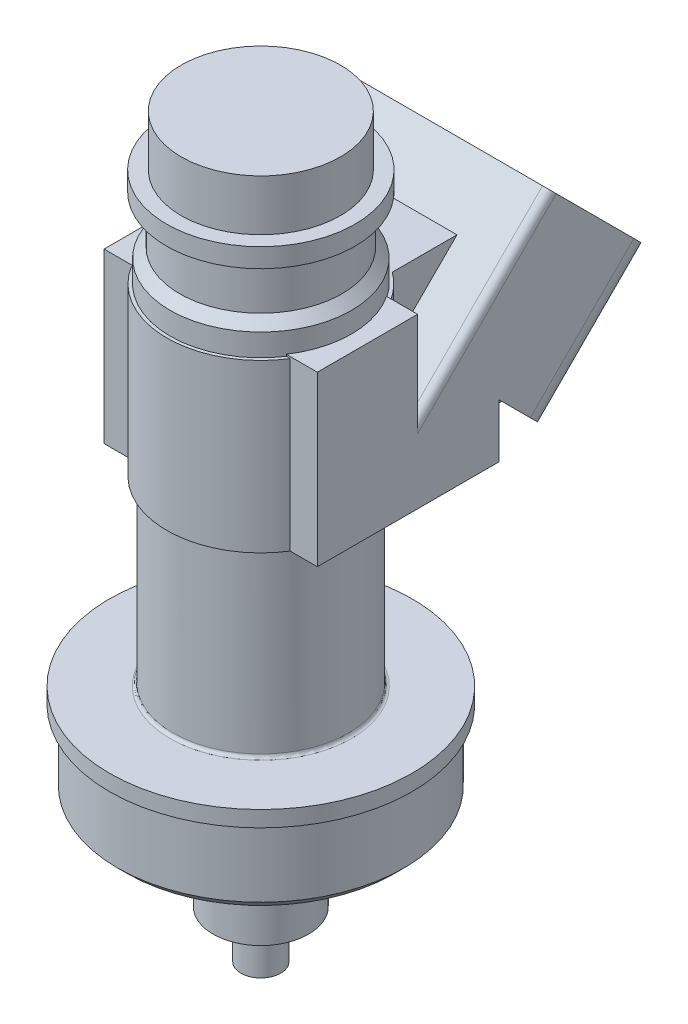
from build123d import *

# Parameters (mm, degrees)
SKETCH1_R          = 1.5875
EXTRUDE1_DEPTH     = 3.81
SKETCH2_R          = 3.81
EXTRUDE2_DEPTH     = 7.62
SKETCH3_R          = 11.43
EXTRUDE3_DEPTH     = 6.35
SKETCH4_R          = 12.065
EXTRUDE4_DEPTH     = 1.27
SKETCH5_R          = 7
EXTRUDE5_DEPTH     = 14.5
SKETCH6_R          = 7.5
EXTRUDE6_DEPTH     = 13.3
SKETCH7_R          = 7.239
EXTRUDE7_DEPTH     = 2.54
CHAMFER6_SIZE      = 0.762
SKETCH8_R          = 6.477
EXTRUDE8_DEPTH     = 3.81
SKETCH9_R          = 0.79375
CUT_EXTRUDE1_DEPTH = 2.54
CHAMFER1_SIZE      = 1.27
CHAMFER1_SIZE2     = 0.462242198
SKETCH10_R         = 7.518539915
EXTRUDE9_DEPTH     = 1.524
SKETCH11_R         = 6.35
EXTRUDE10_DEPTH    = 4.064
FILLET1_R          = 0.254
CHAMFER7_SIZE      = 0.762
EXTRUDE11_DEPTH    = 8.509
SKETCH13_W         = 13.97
SKETCH13_H         = 8.89
CUT_EXTRUDE2_DEPTH = 10.414
SKETCH14_W         = 2.763435098
SKETCH14_H         = 1.082967808
SKETCH14_W_2       = 3.024841121
EXTRUDE12_DEPTH    = 6.35
CHAMFER8_SIZE      = 0.762
FILLET2_R          = 2.54
FILLET3_R          = 0.635
EXTRUDE13_DEPTH    = 4.445


with BuildPart() as part:
    # Sketch1 → Extrude1 (new body)
    with BuildSketch(Plane(origin=(0, 0, 0), x_dir=(1, 0, 0), z_dir=(0, 1, 0))):
        with Locations(Location((0, 0, 0), (0, 0, 90))):
            Circle(SKETCH1_R)
    extrude(amount=EXTRUDE1_DEPTH)

    # Sketch2 → Extrude2 (add)
    with BuildSketch(Plane(origin=(0, 3.81, 0), x_dir=(1, 0, 0), z_dir=(0, 1, 0))):
        with Locations(Location((0, 0, 0), (0, 0, 90))):
            Circle(SKETCH2_R)
    extrude(amount=EXTRUDE2_DEPTH)

    # Sketch3 → Extrude3 (add)
    with BuildSketch(Plane(origin=(0, 11.43, 0), x_dir=(1, 0, 0), z_dir=(0, 1, 0))):
        with Locations(Location((0, 0, 0), (0, 0, 270))):
            Circle(SKETCH3_R)
    extrude(amount=EXTRUDE3_DEPTH)

    # Sketch4 → Extrude4 (add)
    with BuildSketch(Plane(origin=(0, 17.78, 0), x_dir=(1, 0, 0), z_dir=(0, 1, 0))):
        with Locations(Location((0, 0, 0), (0, 0, 270))):
            Circle(SKETCH4_R)
    extrude(amount=EXTRUDE4_DEPTH)

    # Sketch5 → Extrude5 (add)
    with BuildSketch(Plane(origin=(0, 19.05, 0), x_dir=(1, 0, 0), z_dir=(0, 1, 0))):
        with Locations(Location((0, 0, 0), (0, 0, 90))):
            Circle(SKETCH5_R)
    extrude(amount=EXTRUDE5_DEPTH)

    # Sketch6 → Extrude6 (add)
    with BuildSketch(Plane(origin=(0, 33.55, 0), x_dir=(1, 0, 0), z_dir=(0, 1, 0))):
        with Locations(Location((0, 0, 0), (0, 0, 270))):
            Circle(SKETCH6_R)
    extrude(amount=EXTRUDE6_DEPTH)

    # Sketch7 → Extrude7 (add)
    with BuildSketch(Plane(origin=(0, 46.85, 0), x_dir=(1, 0, 0), z_dir=(0, 1, 0))):
        with Locations(Location((0, 0, 0), (0, 0, 270))):
            Circle(SKETCH7_R)
    extrude(amount=EXTRUDE7_DEPTH)

    # Chamfer6
    chamfer6_edges = [part.edges().sort_by_distance(p)[0] for p in [
        (0, 49.39, -7.239),
    ]]
    chamfer(chamfer6_edges, length=CHAMFER6_SIZE)

    # Sketch8 → Extrude8 (add)
    with BuildSketch(Plane(origin=(0, 49.39, 0), x_dir=(1, 0, 0), z_dir=(0, 1, 0))):
        with Locations(Location((0, 0, 0), (0, 0, 90))):
            Circle(SKETCH8_R)
    extrude(amount=EXTRUDE8_DEPTH)

    # Sketch9 → Cut-Extrude1 (cut)
    with BuildSketch(Plane.XZ):
        with Locations(Location((0, 0, 0), (0, 0, 270))):
            Circle(SKETCH9_R)
    extrude(amount=-CUT_EXTRUDE1_DEPTH, mode=Mode.SUBTRACT)

    # Chamfer1
    chamfer1_edges = [part.edges().sort_by_distance(p)[0] for p in [
        (0, 0, 0.79375),
    ]]
    chamfer1_side = [part.faces().sort_by_distance(p)[0] for p in [
        (0, 1.27, 0.79375),
    ]]
    chamfer(chamfer1_edges, length=CHAMFER1_SIZE, length2=CHAMFER1_SIZE2, reference=chamfer1_side[0])

    # Sketch10 → Extrude9 (add)
    with BuildSketch(Plane(origin=(0, 53.2, 0), x_dir=(1, 0, 0), z_dir=(0, 1, 0))):
        with Locations(Location((0, 0, 0), (0, 0, 90))):
            Circle(SKETCH10_R)
    extrude(amount=EXTRUDE9_DEPTH)

    # Sketch11 → Extrude10 (add)
    with BuildSketch(Plane(origin=(0, 54.724, 0), x_dir=(1, 0, 0), z_dir=(0, 1, 0))):
        with Locations(Location((0, 0, 0), (0, 0, 270))):
            Circle(SKETCH11_R)
    extrude(amount=EXTRUDE10_DEPTH)

    # Fillet1
    fillet1_edges = [part.edges().sort_by_distance(p)[0] for p in [
        (0, 19.05, 7),
    ]]
    fillet(fillet1_edges, radius=FILLET1_R)

    # Chamfer7
    chamfer7_edges = [part.edges().sort_by_distance(p)[0] for p in [
        (0, 11.43, -11.43),
    ]]
    chamfer(chamfer7_edges, length=CHAMFER7_SIZE)

    # Sketch12 → Extrude11 (add, symmetric)
    with BuildSketch(Plane(origin=(0, 0, 0), x_dir=(0, 0, -1), z_dir=(1, 0, 0))):
        Polygon((-4.0005, 33.55), (-4.0005, 46.993498834), (4.0005, 46.993498834), (4.0005, 39.645358569), (14.608417816, 50.253276385), (23.049858569, 41.811835631), (14.788022938, 33.55), (10.4775, 37.860522938), (10.4775, 33.55), align=None)
    extrude(amount=EXTRUDE11_DEPTH, both=True)

    # Sketch13 → Cut-Extrude2 (cut)
    with BuildSketch(Plane(origin=(0, 32.4308471, -32.4308471), x_dir=(1, 0, 0), z_dir=(0, 0.7071067811865482, -0.7071067811865468))):
        with Locations((0, -19.235721209)):
            Rectangle(SKETCH13_W, SKETCH13_H)
    extrude(amount=-CUT_EXTRUDE2_DEPTH, mode=Mode.SUBTRACT)

    # Sketch14 → Extrude12 (add)
    with BuildSketch(Plane(origin=(0, 25.067037081, -25.067037081), x_dir=(1, 0, 0), z_dir=(0, 0.7071067811865475, -0.7071067811865477))):
        with Locations((-3.379408051, -24.201118939)):
            Rectangle(SKETCH14_W, SKETCH14_H)
        with Locations((2.091446569, -24.201118939)):
            Rectangle(SKETCH14_W_2, SKETCH14_H)
    extrude(amount=EXTRUDE12_DEPTH)

    # Chamfer8
    chamfer8_edges = [part.edges().sort_by_distance(p)[0] for p in [
        (-1.997690502, 46.294508604, -12.81982168),
        (-4.7611256, 46.294508604, -12.81982168),
        (3.60386713, 46.294508604, -12.81982168),
        (0.579026009, 46.294508604, -12.81982168),
    ]]
    chamfer(chamfer8_edges, length=CHAMFER8_SIZE)

    # Fillet2
    fillet2_edges = [part.edges().sort_by_distance(p)[0] for p in [
        (-8.509, 37.680917816, -18.918940754),
        (8.509, 37.680917816, -18.918940754),
        (6.985, 39.207561356, -18.290322825),
        (-6.985, 39.207561356, -18.290322825),
        (-6.985, 45.493740641, -12.004143541),
        (6.985, 45.493740641, -12.004143541),
    ]]
    fillet(fillet2_edges, radius=FILLET2_R)

    # Fillet3
    fillet3_edges = [part.edges().sort_by_distance(p)[0] for p in [
        (-8.509, 44.949317477, -9.304458908),
        (8.509, 44.949317477, -9.304458908),
    ]]
    fillet(fillet3_edges, radius=FILLET3_R)

    # Sketch15 → Extrude13 (add, symmetric)
    with BuildSketch(Plane(origin=(0, 0, 0), x_dir=(0, 0, -1), z_dir=(1, 0, 0))):
        Polygon((5.360156527, 46.85), (12.103167043, 46.85), (5.360156527, 41.005015096), align=None)
        Polygon((10.4775, 33.55), (14.788022938, 33.55), (10.4775, 37.860522938), align=None)
    extrude(amount=EXTRUDE13_DEPTH, both=True)


solid = part.part
